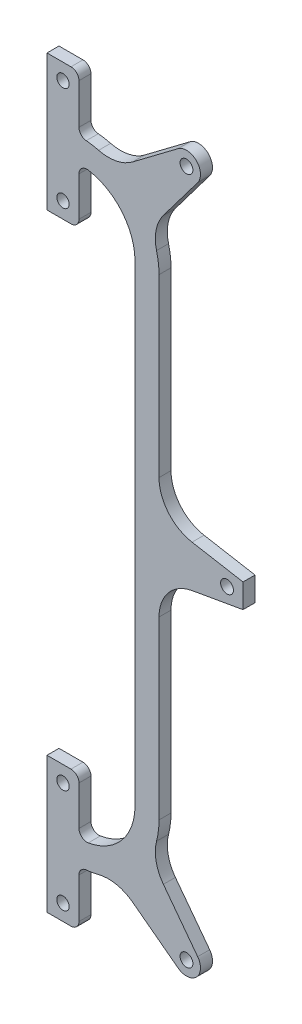
from build123d import *

# Parameters (mm, degrees)
SKETCH_1_R      = 1.55
EXTRUDE_1_DEPTH = 3
FILLET_1_R      = 2
SKETCH_2_R      = 1.6
EXTRUDE_2_DEPTH = 3
FILLET_2_R      = 10
SKETCH_4_R      = 1.6
EXTRUDE_3_DEPTH = 3
FILLET_3_R      = 10


with BuildPart() as part:
    # 草图1 → 凸台-拉伸1 (new body)
    with BuildSketch(Plane.XY):
        with BuildLine():
            Line((4, -17), (-4, -17))
            Line((-4, -17), (-4, 17))
            Line((-4, 17), (4, 17))
            Line((4, 17), (4, 3))
            ThreePointArc((4, 3), (18.142135624, -2.857864376), (24, -17))
            Line((24, -17), (24, -135.02))
            ThreePointArc((24, -135.02), (18.142135624, -149.162135624), (4, -155.02))
            Line((4, -155.02), (4, -169.02))
            Line((4, -169.02), (-4, -169.02))
            Line((-4, -169.02), (-4, -135.02))
            Line((-4, -135.02), (4, -135.02))
            Line((4, -135.02), (4, -149.02))
            ThreePointArc((4, -149.02), (13.899494937, -144.919494937), (18, -135.02))
            Line((18, -135.02), (18, -17))
            ThreePointArc((18, -17), (13.899494937, -7.100505063), (4, -3))
            Line((4, -3), (4, -17))
        make_face()
        with Locations((0, 13)):
            Circle(SKETCH_1_R, mode=Mode.SUBTRACT)
        with Locations((0, -13)):
            Circle(SKETCH_1_R, mode=Mode.SUBTRACT)
        with Locations((0, -139.02)):
            Circle(SKETCH_1_R, mode=Mode.SUBTRACT)
        with Locations((0, -165.02)):
            Circle(SKETCH_1_R, mode=Mode.SUBTRACT)
    extrude(amount=EXTRUDE_1_DEPTH)

    # 圆角1
    fillet_1_edges = [part.edges().sort_by_distance(p)[0] for p in [
        (4, -3, 1.5),
        (4, -17, 1.5),
        (4, 17, 1.5),
        (4, 3, 1.5),
        (4, -155.02, 1.5),
        (4, -169.02, 1.5),
        (4, -135.02, 1.5),
        (4, -149.02, 1.5),
    ]]
    fillet(fillet_1_edges, radius=FILLET_1_R)

    # 草图2 → 凸台-拉伸2 (add)
    with BuildSketch(Plane.XY):
        with BuildLine():
            Line((13.058826075, 0.830806772), (28.763705104, 12.66528197))
            ThreePointArc((28.763705104, 12.66528197), (33.344931419, 12.344931419), (33.66528197, 7.763705104))
            Line((33.66528197, 7.763705104), (21.830806772, -7.941173925))
            ThreePointArc((21.830806772, -7.941173925), (18.142135624, -2.857864376), (13.058826075, 0.830806772))
        make_face()
        with Locations((30.870057685, 9.870057685)):
            Circle(SKETCH_2_R, mode=Mode.SUBTRACT)
    extrude_2 = extrude(amount=EXTRUDE_2_DEPTH)

    # 镜向5: 凸台-拉伸2 across plane
    add(extrude_2.mirror(Plane.ZX.offset(-76.01)))

    # 圆角2
    fillet_2_edges = [part.edges().sort_by_distance(p)[0] for p in [
        (21.830806772, -7.941173925, 1.5),
        (13.058826075, 0.830806772, 1.5),
        (21.830806772, -144.078826075, 1.5),
        (13.058826075, -152.850806772, 1.5),
    ]]
    fillet(fillet_2_edges, radius=FILLET_2_R)

    # 草图4 → 凸台-拉伸3 (add)
    with BuildSketch(Plane.XY.offset(3)):
        Polygon((24, -69.307133405), (45, -73.01), (45, -79.01), (24, -82.712866595), align=None)
        with Locations((41, -76.01)):
            Circle(SKETCH_4_R, mode=Mode.SUBTRACT)
    extrude(amount=-EXTRUDE_3_DEPTH)

    # 圆角3
    fillet_3_edges = [part.edges().sort_by_distance(p)[0] for p in [
        (24, -69.307133405, 1.5),
        (24, -82.712866595, 1.5),
    ]]
    fillet(fillet_3_edges, radius=FILLET_3_R)


solid = part.part
